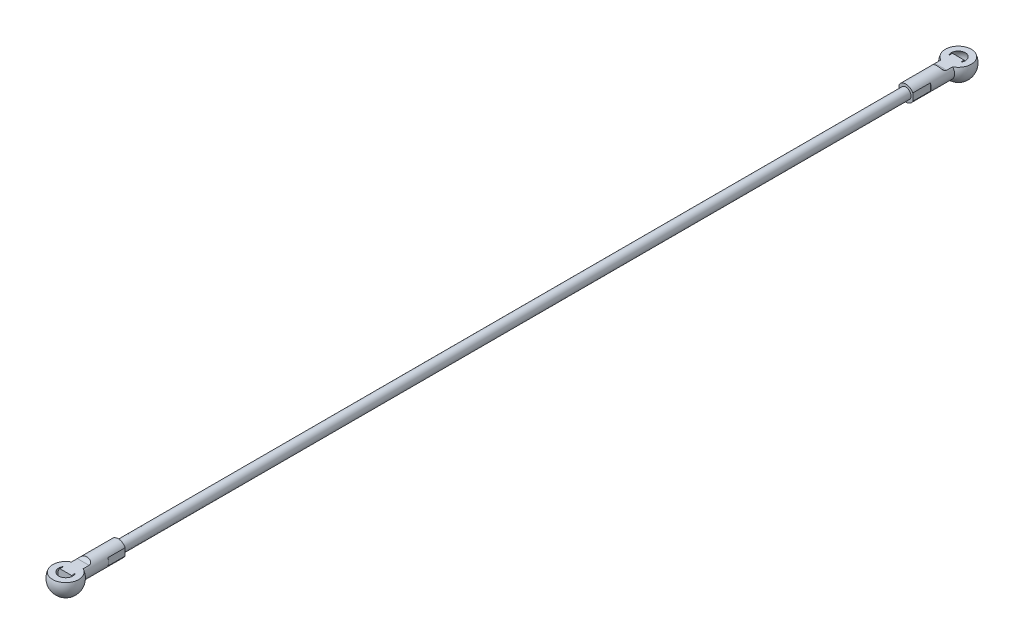
from build123d import *

# Parameters (mm, degrees)
SKETCH_2_R               = 3
EXTRUDE_1_DEPTH          = 510
SKETCH_7_R               = 4.5
EXTRUDE_2_DEPTH          = 30
CUT_EXTRUDE_1_DEPTH      = 519.123537392
CUT_EXTRUDE_1_DEPTH_BACK = 519.123537392
EXTRUDE_START            = -30
SKETCH_9_R               = 4.5
EXTRUDE_3_DEPTH          = 30
CUT_EXTRUDE_2_DEPTH      = 30
CUT_EXTRUDE_2_DEPTH_BACK = 30
CUT_EXTRUDE_3_DEPTH      = 30
CUT_EXTRUDE_3_DEPTH_BACK = 30
SKETCH_11_W              = 5.925666616
SKETCH_11_H              = 14.898307071
SKETCH_11_W_2            = 6.139683371
SKETCH_11_W_3            = 15.578698717
SKETCH_11_H_2            = 21.382269556
SKETCH_11_W_4            = 12.448960945


with BuildPart() as part:
    # 草图1 → 旋转4 (revolve)
    with BuildSketch(Plane.XY):
        with BuildLine():
            Line((-7.416198487, 3), (-4, 3))
            ThreePointArc((-4, 3), (-4.472135955, -2.236067977), (0, -5))
            Line((0, -5), (0, -8))
            ThreePointArc((0, -8), (-6.633249581, -4.472135955), (-7.416198487, 3))
        make_face()
    revolve(axis=Axis((0, -1000, 0), (0, 1, 0)))

    # 草图2 → 拉伸1 (add)
    with BuildSketch(Plane.XY):
        Circle(SKETCH_2_R)
    extrude(amount=EXTRUDE_1_DEPTH)

    # 草图4 → 切除-旋转1 (revolve, cut)
    with BuildSketch(Plane.XY):
        with BuildLine():
            Line((0, -5), (0, 5))
            ThreePointArc((0, 5), (-5, 0), (0, -5))
        make_face()
    revolve(axis=Axis((0, -1000, 0), (0, 1, 0)), mode=Mode.SUBTRACT)

    # 草图6 → 旋转6 (revolve)
    with BuildSketch(Plane.XY.offset(510)):
        with BuildLine():
            Line((-4, 3), (-7.416198487, 3))
            ThreePointArc((-7.416198487, 3), (-6.633249581, -4.472135955), (0, -8))
            Line((0, -8), (0, -5))
            ThreePointArc((0, -5), (-4.472135955, -2.236067978), (-4, 3))
        make_face()
    revolve(axis=Axis((0, -1000, 510), (0, 1, 0)))

    # 草图7 → 拉伸2 (add)
    with BuildSketch(Plane.XY):
        Circle(SKETCH_7_R)
    extrude(amount=EXTRUDE_2_DEPTH)

    # 草图8 → 切除-拉伸1 (cut, two sides: drawn at the far end of the back side and taken through both)
    with BuildSketch(Plane(origin=(0, 0, 0), x_dir=(0, 0, -1), z_dir=(1, 0, 0)).offset(-CUT_EXTRUDE_1_DEPTH_BACK)):
        with BuildLine():
            Line((7.416198487, 3), (-10, 3))
            ThreePointArc((-10, 3), (-11.291313525, 3.41344103), (-12.102370681, 4.5))
            Line((-12.102370681, 4.5), (0, 4.5))
            Line((0, 4.5), (7.416198487, 3))
        make_face()
    extrude(amount=CUT_EXTRUDE_1_DEPTH + CUT_EXTRUDE_1_DEPTH_BACK, mode=Mode.SUBTRACT)

    # 草图9 → 拉伸3 (add)
    with BuildSketch(Plane.XY.offset(510).offset(EXTRUDE_START)):
        Circle(SKETCH_9_R)
    extrude(amount=EXTRUDE_3_DEPTH)

    # 草图10 → 切除-拉伸2 (cut, two sides: drawn at the far end of the back side and taken through both)
    with BuildSketch(Plane(origin=(0, 0, 0), x_dir=(0, 0, -1), z_dir=(1, 0, 0)).offset(-CUT_EXTRUDE_2_DEPTH_BACK)):
        with BuildLine():
            Line((-522.263931155, 3), (-500, 3))
            ThreePointArc((-500, 3), (-498.712997614, 3.413758441), (-497.908230279, 4.5))
            Line((-497.908230279, 4.5), (-522.188391586, 4.5))
            Line((-522.188391586, 4.5), (-522.263931155, 3))
        make_face()
    extrude(amount=CUT_EXTRUDE_2_DEPTH + CUT_EXTRUDE_2_DEPTH_BACK, mode=Mode.SUBTRACT)

    # 草图11 → 切除-拉伸3 (cut, two sides: drawn at the far end of the back side and taken through both)
    with BuildSketch(Plane(origin=(0, 3, 0), x_dir=(-1, 0, 0), z_dir=(0, 1, 0)).offset(-CUT_EXTRUDE_3_DEPTH_BACK)):
        with Locations((-6.962833308, 482.550846465)):
            Rectangle(SKETCH_11_W, SKETCH_11_H)
        with Locations((7.069841686, 482.550846465)):
            Rectangle(SKETCH_11_W_2, SKETCH_11_H)
        with Locations((-11.789349359, 30.691134778)):
            Rectangle(SKETCH_11_W_3, SKETCH_11_H_2)
        with Locations((10.224480472, 30.691134778)):
            Rectangle(SKETCH_11_W_4, SKETCH_11_H_2)
    extrude(amount=CUT_EXTRUDE_3_DEPTH + CUT_EXTRUDE_3_DEPTH_BACK, mode=Mode.SUBTRACT)


solid = part.part
